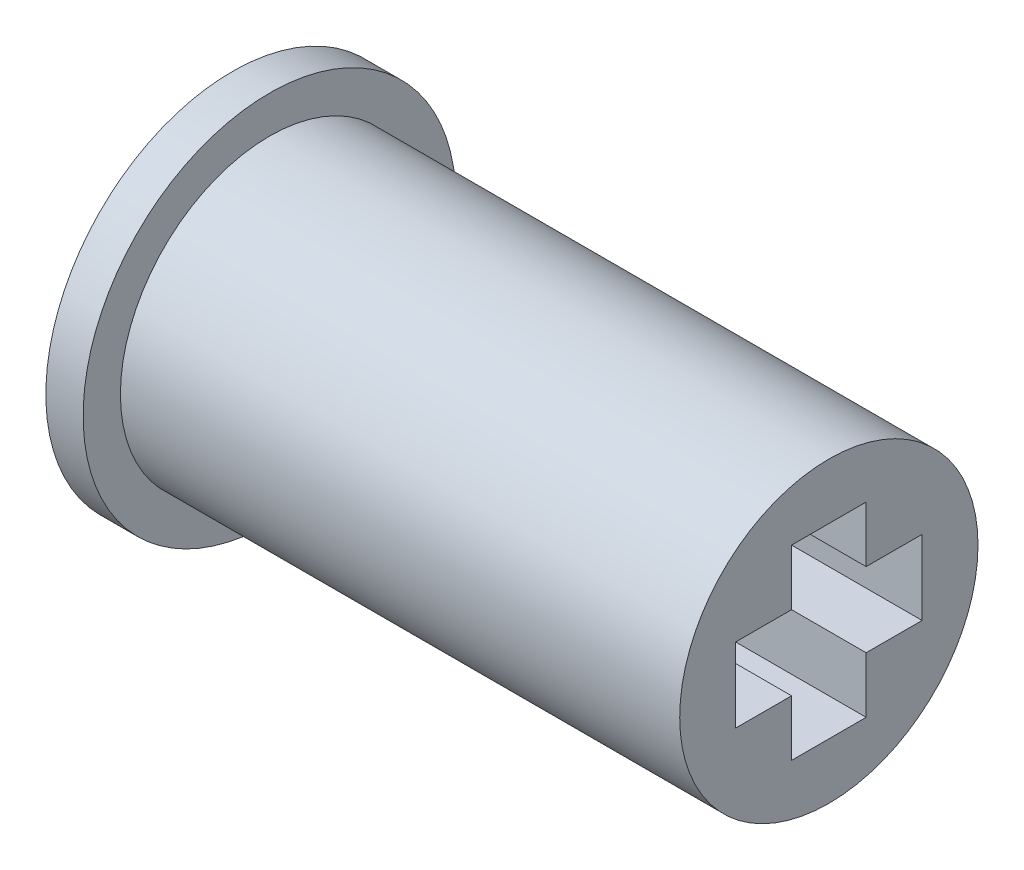
from build123d import *

# Parameters (mm, degrees)
SKETCH1_R           = 5
BOSS_EXTRUDE2_DEPTH = 1
SKETCH2_R           = 4
BOSS_EXTRUDE3_DEPTH = 15
CUT_EXTRUDE1_DEPTH  = 15


with BuildPart() as part:
    # Sketch1 → Boss-Extrude2 (new body)
    with BuildSketch(Plane(origin=(0, 0, 0), x_dir=(0, 0, -1), z_dir=(1, 0, 0))):
        Circle(SKETCH1_R)
    extrude(amount=BOSS_EXTRUDE2_DEPTH)

    # Sketch2 → Boss-Extrude3 (add)
    with BuildSketch(Plane(origin=(1, 0, 0), x_dir=(0, 0, -1), z_dir=(1, 0, 0))):
        Circle(SKETCH2_R)
    extrude(amount=BOSS_EXTRUDE3_DEPTH)

    # Sketch4 → Cut-Extrude1 (cut)
    with BuildSketch(Plane(origin=(16, 0, 0), x_dir=(0, 0, -1), z_dir=(1, 0, 0))):
        Polygon((1, 2.5), (0, 2.5), (-1, 2.5), (-1, 1), (0, 1), (1, 1), align=None)
        Polygon((0, 1), (-1, 1), (-1, 0), (-1, -1), (-0.604082815, -1), (1, -1), (1, 0), (1, 1), align=None)
        Polygon((2.5, 1), (1, 1), (1, 0), (1, -1), (2.5, -1), (2.5, 0), align=None)
        Polygon((-1, 0), (-1, 1), (-2.5, 1), (-2.5, 0), (-2.5, -1), (-1, -1), align=None)
        Polygon((-0.604082815, -1), (-1, -1), (-1, -2.5), (-0.604082815, -2.5), (1, -2.5), (1, -1), align=None)
    extrude(amount=-CUT_EXTRUDE1_DEPTH, mode=Mode.SUBTRACT)


solid = part.part
